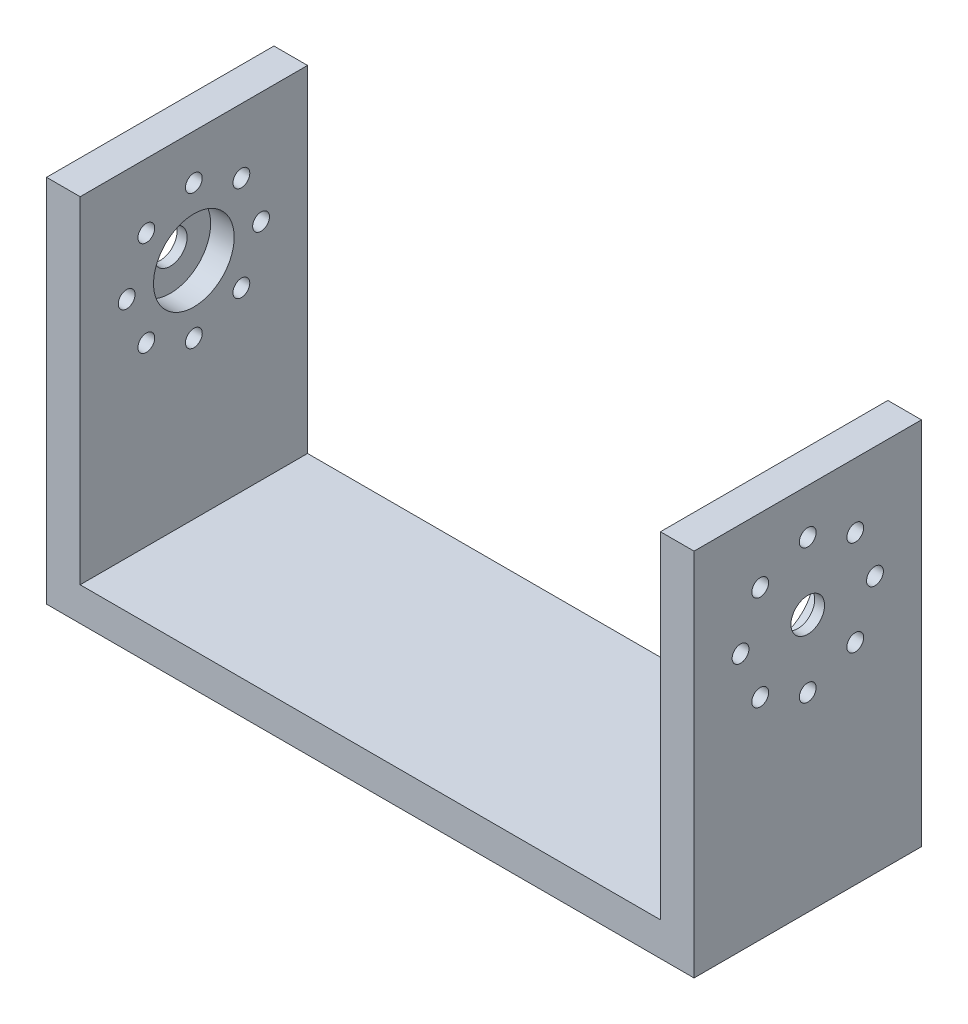
from build123d import *

# Parameters (mm, degrees)
SKETCH1_W               = 57.8
SKETCH1_H               = 20.3
YAWMOUNT_DEPTH          = 3
SKETCH2_W               = 3
SKETCH2_H               = 20.3
BODYCONNECTORS_DEPTH    = 30
AXLE_MOUNTS_REACH       = 71.584
SKETCH3_R               = 1.5
SKETCH3_R_2             = 0.75
SKETCH4_R               = 3.6
SLIDE_COUNTERBORE_DEPTH = 2.12
GEAR_COUNTERBORE_START  = -2.1
SKETCH5_R               = 3.6
GEAR_COUNTERBORE_DEPTH  = 2.1


with BuildPart() as part:
    # Sketch1 → YawMount (new body)
    with BuildSketch(Plane(origin=(0, 0, 0), x_dir=(1, 0, 0), z_dir=(0, 1, 0))):
        with Locations((28.9, 10.15)):
            Rectangle(SKETCH1_W, SKETCH1_H)
    extrude(amount=YAWMOUNT_DEPTH)

    # Sketch2 → BodyConnectors (add)
    with BuildSketch(Plane(origin=(0, 3, 0), x_dir=(1, 0, 0), z_dir=(0, 1, 0))):
        with Locations((1.5, 10.15)):
            Rectangle(SKETCH2_W, SKETCH2_H)
        with Locations((56.3, 10.15)):
            Rectangle(SKETCH2_W, SKETCH2_H)
    extrude(amount=BODYCONNECTORS_DEPTH)

    # Axle-Mounts: up to this face of the body (flat: up to its plane)
    axle_mounts_end = Plane(part.part.faces().sort_by_distance((0, 16.5, -10.15))[0])
    # Sketch3 → Axle-Mounts (cut, up to the picked face)
    with BuildSketch(Plane(origin=(57.8, 0, 0), x_dir=(0, 0, -1), z_dir=(1, 0, 0)), mode=Mode.PRIVATE) as axle_mounts_sk1:
        with Locations((10.15, 23)):
            Circle(SKETCH3_R)
    axle_mounts_tool1 = split(extrude(axle_mounts_sk1.sketch, amount=-AXLE_MOUNTS_REACH, mode=Mode.PRIVATE), bisect_by=axle_mounts_end, keep=Keep.BOTH, mode=Mode.PRIVATE)
    # Sketch3 → Axle-Mounts (cut, up to the picked face)
    with BuildSketch(Plane(origin=(57.8, 0, 0), x_dir=(0, 0, -1), z_dir=(1, 0, 0)), mode=Mode.PRIVATE) as axle_mounts_sk2:
        with Locations((16.15, 23)):
            Circle(SKETCH3_R_2)
    axle_mounts_tool2 = split(extrude(axle_mounts_sk2.sketch, amount=-AXLE_MOUNTS_REACH, mode=Mode.PRIVATE), bisect_by=axle_mounts_end, keep=Keep.BOTH, mode=Mode.PRIVATE)
    # Sketch3 → Axle-Mounts (cut, up to the picked face)
    with BuildSketch(Plane(origin=(57.8, 0, 0), x_dir=(0, 0, -1), z_dir=(1, 0, 0)), mode=Mode.PRIVATE) as axle_mounts_sk3:
        with Locations((14.392640687, 18.757359313)):
            Circle(SKETCH3_R_2)
    axle_mounts_tool3 = split(extrude(axle_mounts_sk3.sketch, amount=-AXLE_MOUNTS_REACH, mode=Mode.PRIVATE), bisect_by=axle_mounts_end, keep=Keep.BOTH, mode=Mode.PRIVATE)
    # Sketch3 → Axle-Mounts (cut, up to the picked face)
    with BuildSketch(Plane(origin=(57.8, 0, 0), x_dir=(0, 0, -1), z_dir=(1, 0, 0)), mode=Mode.PRIVATE) as axle_mounts_sk4:
        with Locations((10.15, 17)):
            Circle(SKETCH3_R_2)
    axle_mounts_tool4 = split(extrude(axle_mounts_sk4.sketch, amount=-AXLE_MOUNTS_REACH, mode=Mode.PRIVATE), bisect_by=axle_mounts_end, keep=Keep.BOTH, mode=Mode.PRIVATE)
    # Sketch3 → Axle-Mounts (cut, up to the picked face)
    with BuildSketch(Plane(origin=(57.8, 0, 0), x_dir=(0, 0, -1), z_dir=(1, 0, 0)), mode=Mode.PRIVATE) as axle_mounts_sk5:
        with Locations((5.907359313, 18.757359313)):
            Circle(SKETCH3_R_2)
    axle_mounts_tool5 = split(extrude(axle_mounts_sk5.sketch, amount=-AXLE_MOUNTS_REACH, mode=Mode.PRIVATE), bisect_by=axle_mounts_end, keep=Keep.BOTH, mode=Mode.PRIVATE)
    # Sketch3 → Axle-Mounts (cut, up to the picked face)
    with BuildSketch(Plane(origin=(57.8, 0, 0), x_dir=(0, 0, -1), z_dir=(1, 0, 0)), mode=Mode.PRIVATE) as axle_mounts_sk6:
        with Locations((4.15, 23)):
            Circle(SKETCH3_R_2)
    axle_mounts_tool6 = split(extrude(axle_mounts_sk6.sketch, amount=-AXLE_MOUNTS_REACH, mode=Mode.PRIVATE), bisect_by=axle_mounts_end, keep=Keep.BOTH, mode=Mode.PRIVATE)
    # Sketch3 → Axle-Mounts (cut, up to the picked face)
    with BuildSketch(Plane(origin=(57.8, 0, 0), x_dir=(0, 0, -1), z_dir=(1, 0, 0)), mode=Mode.PRIVATE) as axle_mounts_sk7:
        with Locations((5.907359313, 27.242640687)):
            Circle(SKETCH3_R_2)
    axle_mounts_tool7 = split(extrude(axle_mounts_sk7.sketch, amount=-AXLE_MOUNTS_REACH, mode=Mode.PRIVATE), bisect_by=axle_mounts_end, keep=Keep.BOTH, mode=Mode.PRIVATE)
    # Sketch3 → Axle-Mounts (cut, up to the picked face)
    with BuildSketch(Plane(origin=(57.8, 0, 0), x_dir=(0, 0, -1), z_dir=(1, 0, 0)), mode=Mode.PRIVATE) as axle_mounts_sk8:
        with Locations((10.15, 29)):
            Circle(SKETCH3_R_2)
    axle_mounts_tool8 = split(extrude(axle_mounts_sk8.sketch, amount=-AXLE_MOUNTS_REACH, mode=Mode.PRIVATE), bisect_by=axle_mounts_end, keep=Keep.BOTH, mode=Mode.PRIVATE)
    # Sketch3 → Axle-Mounts (cut, up to the picked face)
    with BuildSketch(Plane(origin=(57.8, 0, 0), x_dir=(0, 0, -1), z_dir=(1, 0, 0)), mode=Mode.PRIVATE) as axle_mounts_sk9:
        with Locations((14.392640687, 27.242640687)):
            Circle(SKETCH3_R_2)
    axle_mounts_tool9 = split(extrude(axle_mounts_sk9.sketch, amount=-AXLE_MOUNTS_REACH, mode=Mode.PRIVATE), bisect_by=axle_mounts_end, keep=Keep.BOTH, mode=Mode.PRIVATE)
    add(axle_mounts_tool1.solids().sort_by(Axis((57.8, 23, -10.15), (-1, 0, 0)))[0], mode=Mode.SUBTRACT)
    add(axle_mounts_tool2.solids().sort_by(Axis((57.8, 23, -16.15), (-1, 0, 0)))[0], mode=Mode.SUBTRACT)
    add(axle_mounts_tool3.solids().sort_by(Axis((57.8, 18.757359, -14.392641), (-1, 0, 0)))[0], mode=Mode.SUBTRACT)
    add(axle_mounts_tool4.solids().sort_by(Axis((57.8, 17, -10.15), (-1, 0, 0)))[0], mode=Mode.SUBTRACT)
    add(axle_mounts_tool5.solids().sort_by(Axis((57.8, 18.757359, -5.907359), (-1, 0, 0)))[0], mode=Mode.SUBTRACT)
    add(axle_mounts_tool6.solids().sort_by(Axis((57.8, 23, -4.15), (-1, 0, 0)))[0], mode=Mode.SUBTRACT)
    add(axle_mounts_tool7.solids().sort_by(Axis((57.8, 27.242641, -5.907359), (-1, 0, 0)))[0], mode=Mode.SUBTRACT)
    add(axle_mounts_tool8.solids().sort_by(Axis((57.8, 29, -10.15), (-1, 0, 0)))[0], mode=Mode.SUBTRACT)
    add(axle_mounts_tool9.solids().sort_by(Axis((57.8, 27.242641, -14.392641), (-1, 0, 0)))[0], mode=Mode.SUBTRACT)

    # Sketch4 → Slide-Counterbore (cut)
    with BuildSketch(Plane.ZY.offset(-54.8)):
        with Locations((-10.15, 23)):
            Circle(SKETCH4_R)
    extrude(amount=-SLIDE_COUNTERBORE_DEPTH, mode=Mode.SUBTRACT)

    # Sketch5 → Gear-Counterbore (cut)
    with BuildSketch(Plane(origin=(3, 0, 0), x_dir=(0, 0, -1), z_dir=(1, 0, 0)).offset(GEAR_COUNTERBORE_START)):
        with Locations(Location((10.15, 23, 0), (0, 0, 180))):
            Circle(SKETCH5_R)
    extrude(amount=GEAR_COUNTERBORE_DEPTH, mode=Mode.SUBTRACT)


solid = part.part
